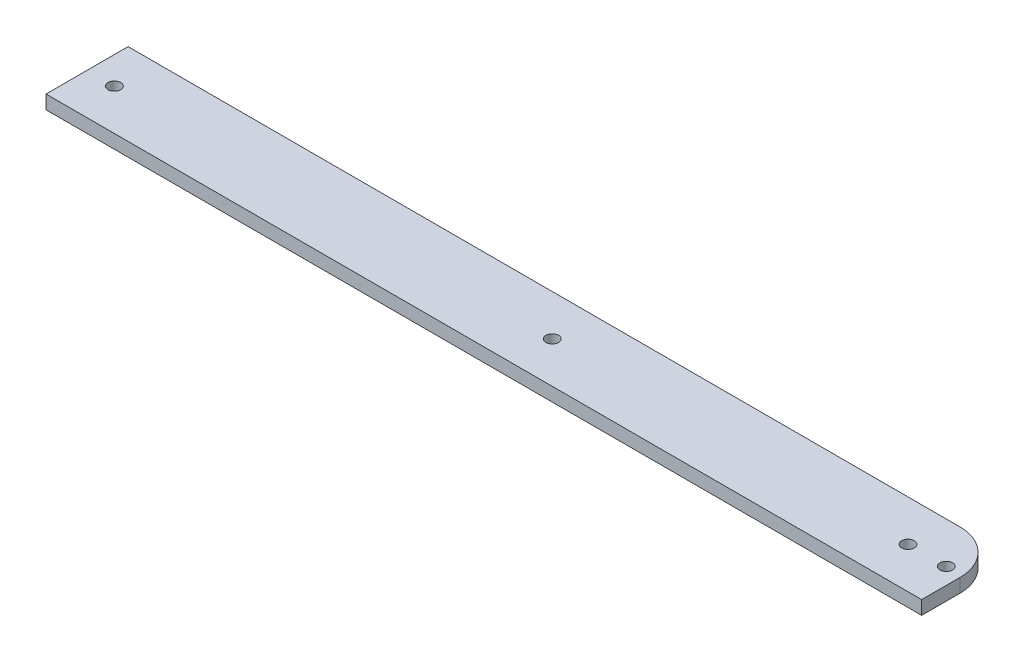
from build123d import *

# Parameters (mm, degrees)
SKETCH1_W           = 203.2
SKETCH1_H           = 19.05
SKETCH1_R           = 1.4605
BOSS_EXTRUDE1_DEPTH = 3.175
SKETCH2_R           = 1.4605
CUT_EXTRUDE1_DEPTH  = 205.115710138
FILLET1_R           = 10.16


with BuildPart() as part:
    # Sketch1 → Boss-Extrude1 (new body)
    with BuildSketch(Plane(origin=(0, 0, 0), x_dir=(1, 0, 0), z_dir=(0, 1, 0))):
        with Locations((101.6, 9.525)):
            Rectangle(SKETCH1_W, SKETCH1_H)
        with Locations(Location((6.35, 9.525, 0), (0, 0, 270))):
            Circle(SKETCH1_R, mode=Mode.SUBTRACT)
        with Locations(Location((107.95, 9.525, 0), (0, 0, 270))):
            Circle(SKETCH1_R, mode=Mode.SUBTRACT)
    extrude(amount=BOSS_EXTRUDE1_DEPTH)

    # Sketch2 → Cut-Extrude1 (cut, through all)
    with BuildSketch(Plane(origin=(0, 0, 0), x_dir=(-1, 0, 0), z_dir=(0, -1, 0))):
        with Locations(Location((-199.39, 9.525, 0), (0, 0, 90))):
            Circle(SKETCH2_R)
        with Locations(Location((-190.5, 9.525, 0), (0, 0, 90))):
            Circle(SKETCH2_R)
    extrude(amount=-CUT_EXTRUDE1_DEPTH, mode=Mode.SUBTRACT)

    # Fillet1
    fillet1_edges = [part.edges().sort_by_distance(p)[0] for p in [
        (203.2, 1.5875, -19.05),
    ]]
    fillet(fillet1_edges, radius=FILLET1_R)


solid = part.part
